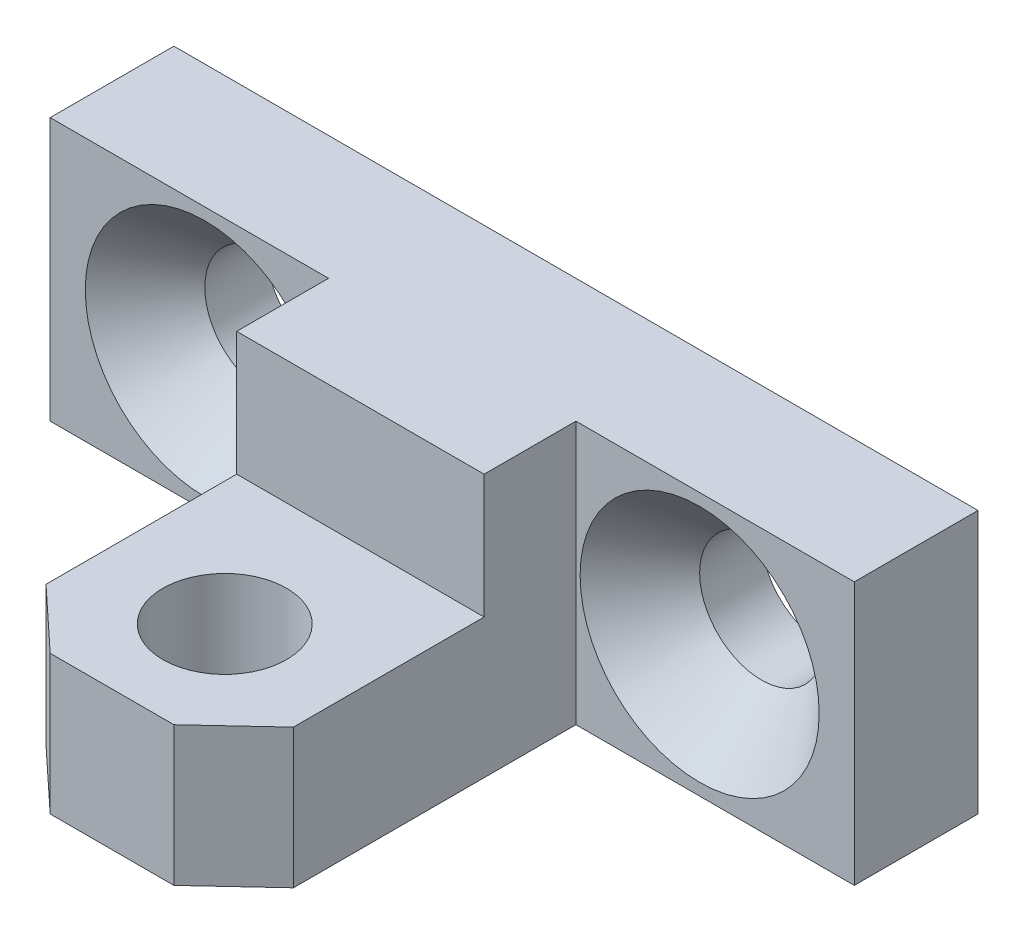
from build123d import *
from OCP.BRepFilletAPI import BRepFilletAPI_MakeChamfer

# Parameters (mm, degrees)
SKETCH_1_W            = 26
SKETCH_1_H            = 8.5
EXTRUDE_1_DEPTH       = 15
SKETCH_2_W            = 9
SKETCH_2_H            = 17.151512959
CUT_EXTRUDE_2_DEPTH   = 20
CHAMFER_1_SIZE        = 2
CHAMFER_1_SIZE2       = 1.865030172
SKETCH_3_R            = 2
CUT_EXTRUDE_1_DEPTH   = 32.19695498
CHAMFER_2_SIZE        = 2
CHAMFER_2_SIZE2       = 1.865030172
SKETCH_4_W            = 11.3471837
SKETCH_4_H            = 8.882896331
CUT_EXTRUDE_2_2_DEPTH = 4
SKETCH_5_R            = 2
CUT_EXTRUDE_3_DEPTH   = 31.352100422


with BuildPart() as part:
    # Эскиз1 → Вытянуть1 (new body)
    with BuildSketch(Plane.XY):
        with Locations((13, -4.25)):
            Rectangle(SKETCH_1_W, SKETCH_1_H)
    extrude(amount=EXTRUDE_1_DEPTH)

    # Эскиз2 → Cut-Extrude 2 (cut)
    with BuildSketch(Plane(origin=(0, 0, 0), x_dir=(1, 0, 0), z_dir=(0, 1, 0))):
        with Locations((4.5, -12.57575648)):
            Rectangle(SKETCH_2_W, SKETCH_2_H)
        with Locations((21.5, -12.57575648)):
            Rectangle(SKETCH_2_W, SKETCH_2_H)
    extrude(amount=-CUT_EXTRUDE_2_DEPTH, mode=Mode.SUBTRACT)

    # Фаска1
    chamfer_1_edges = [part.edges().sort_by_distance(p)[0] for p in [
        (9, -4.25, 15),
        (17, -4.25, 15),
    ]]
    chamfer_1_side = [part.faces().sort_by_distance(p)[0] for p in [
        (13, -4.25, 15),
    ]]
    chamfer(chamfer_1_edges, length=CHAMFER_1_SIZE, length2=CHAMFER_1_SIZE2, reference=chamfer_1_side[0])

    # Эскиз3 → Вырез-Вытянуть1 (cut, through all)
    with BuildSketch(Plane(origin=(0, 0, 0), x_dir=(-1, 0, 0), z_dir=(0, 0, -1))):
        with Locations((-21, -4.250000001)):
            Circle(SKETCH_3_R)
        with Locations((-5, -4.251501777)):
            Circle(SKETCH_3_R)
    extrude(amount=-CUT_EXTRUDE_1_DEPTH, mode=Mode.SUBTRACT)

    # Фаска2: one chamfer whose edges measure the first distance from different faces: ONE call of the kernel's chamfer builder (chamfer() names one face for all edges)
    chamfer_2_edges_1 = [part.edges().sort_by_distance(p)[0] for p in [
        (23, -4.250000001, 4),
    ]]
    chamfer_2_side_1 = [part.faces().sort_by_distance(p)[0] for p in [
        (23, -4.250000001, 2),
    ]]
    chamfer_2_edges_2 = [part.edges().sort_by_distance(p)[0] for p in [
        (7, -4.251501777, 4),
    ]]
    chamfer_2_side_2 = [part.faces().sort_by_distance(p)[0] for p in [
        (7, -4.251501777, 2),
    ]]
    chamfer_2 = BRepFilletAPI_MakeChamfer(part.part.solid().wrapped)
    for e in chamfer_2_edges_1:
        chamfer_2.Add(CHAMFER_2_SIZE, CHAMFER_2_SIZE2, e.wrapped, chamfer_2_side_1[0].wrapped)  # the first distance lies on this face
    for e in chamfer_2_edges_2:
        chamfer_2.Add(CHAMFER_2_SIZE, CHAMFER_2_SIZE2, e.wrapped, chamfer_2_side_2[0].wrapped)  # the first distance lies on this face
    add(Compound.cast(chamfer_2.Shape()), mode=Mode.REPLACE)

    # Эскиз4 → Cut-Extrude 2 2 (cut)
    with BuildSketch(Plane(origin=(0, 0, 0), x_dir=(1, 0, 0), z_dir=(0, 1, 0))):
        with Locations((13.06322118, -11.410294164)):
            Rectangle(SKETCH_4_W, SKETCH_4_H)
    extrude(amount=-CUT_EXTRUDE_2_2_DEPTH, mode=Mode.SUBTRACT)

    # Эскиз5 → Вырез-Вытянуть3 (cut, through all)
    with BuildSketch(Plane(origin=(0, -4, 0), x_dir=(1, 0, 0), z_dir=(0, 1, 0))):
        with Locations(Location((13, -11.355717768, 0), (0, 0, 270))):
            Circle(SKETCH_5_R)
    extrude(amount=-CUT_EXTRUDE_3_DEPTH, mode=Mode.SUBTRACT)


solid = part.part
